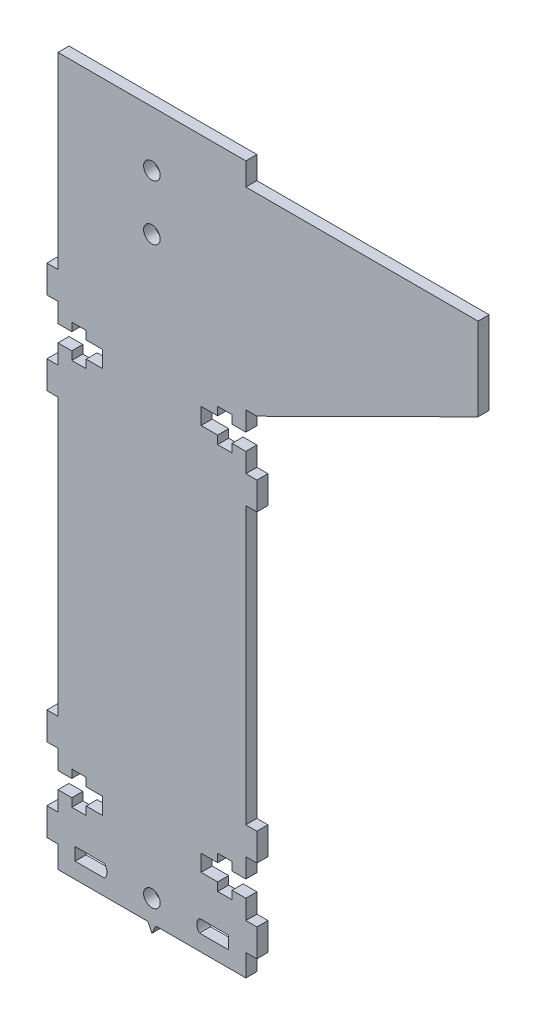
from build123d import *

# Parameters (mm, degrees)
SKETCH_1_R      = 1.5
EXTRUDE_1_DEPTH = 2


with BuildPart() as part:
    # 草图1 → 凸台-拉伸1 (new body)
    with BuildSketch(Plane.XY):
        Polygon((16.993865071, 15.9), (16.993865071, 20), (-16.993865071, 20), (-16.993865071, 15.9), (-16.993865071, -14), (-18.993865071, -14), (-18.993865071, -19), (-16.993865071, -19), (-16.993865071, -22.5), (-14.493865071, -22.5), (-14.493865071, -21), (-11.893865071, -21), (-11.893865071, -22.5), (-8.893865071, -22.5), (-8.893865071, -25.5), (-11.893865071, -25.5), (-11.893865071, -27), (-14.493865071, -27), (-14.493865071, -25.5), (-16.993865071, -25.5), (-16.993865071, -29), (-18.993865071, -29), (-18.993865071, -34), (-16.993865071, -34), (-16.993865071, -84), (-18.993865071, -84), (-18.993865071, -89), (-16.993865071, -89), (-16.993865071, -92.5), (-14.493865071, -92.5), (-14.493865071, -91), (-11.893865071, -91), (-11.893865071, -92.5), (-8.893865071, -92.5), (-8.893865071, -95.5), (-11.893865071, -95.5), (-11.893865071, -97), (-14.493865071, -97), (-14.493865071, -95.5), (-16.993865071, -95.5), (-16.993865071, -99), (-18.993865071, -99), (-18.993865071, -104), (-16.993865071, -104), (-16.993865071, -108), (-0.721190694, -108), (0, -109.5), (0.721190694, -108), (16.993865071, -108), (16.993865071, -104), (18.993865071, -104), (18.993865071, -99), (16.993865071, -99), (16.993865071, -95.5), (14.493865071, -95.5), (14.493865071, -97), (11.893865071, -97), (11.893865071, -95.5), (8.893865071, -95.5), (8.893865071, -92.5), (11.893865071, -92.5), (11.893865071, -91), (14.493865071, -91), (14.493865071, -92.5), (16.993865071, -92.5), (16.993865071, -89), (18.993865071, -89), (18.993865071, -84), (16.993865071, -84), (16.993865071, -34), (18.993865071, -34), (18.993865071, -29), (16.993865071, -29), (16.993865071, -25.5), (14.493865071, -25.5), (14.493865071, -27), (11.893865071, -27), (11.893865071, -25.5), (8.893865071, -25.5), (8.893865071, -22.5), (11.893865071, -22.5), (11.893865071, -21), (14.493865071, -21), (14.493865071, -22.5), (16.993865071, -22.5), (16.993865071, -19), (18.993865071, -19), (58.993865071, 0.9), (58.993865071, 15.9), align=None)
        with Locations((0, -104)):
            Circle(SKETCH_1_R, mode=Mode.SUBTRACT)
        Circle(SKETCH_1_R, mode=Mode.SUBTRACT)
        with Locations((0, 10)):
            Circle(SKETCH_1_R, mode=Mode.SUBTRACT)
        with BuildLine():
            Line((-13.9, -102.85), (-8.6, -102.85))
            ThreePointArc((-8.6, -102.85), (-8.123654403, -104), (-8.6, -105.15))
            Line((-8.6, -105.15), (-13.9, -105.15))
            Line((-13.9, -105.15), (-13.9, -102.85))
        make_face(mode=Mode.SUBTRACT)
        with BuildLine():
            Line((13.9, -105.15), (8.6, -105.15))
            ThreePointArc((8.6, -105.15), (8.123654403, -104), (8.6, -102.85))
            Line((8.6, -102.85), (13.9, -102.85))
            Line((13.9, -102.85), (13.9, -105.15))
        make_face(mode=Mode.SUBTRACT)
    extrude(amount=EXTRUDE_1_DEPTH)


solid = part.part
